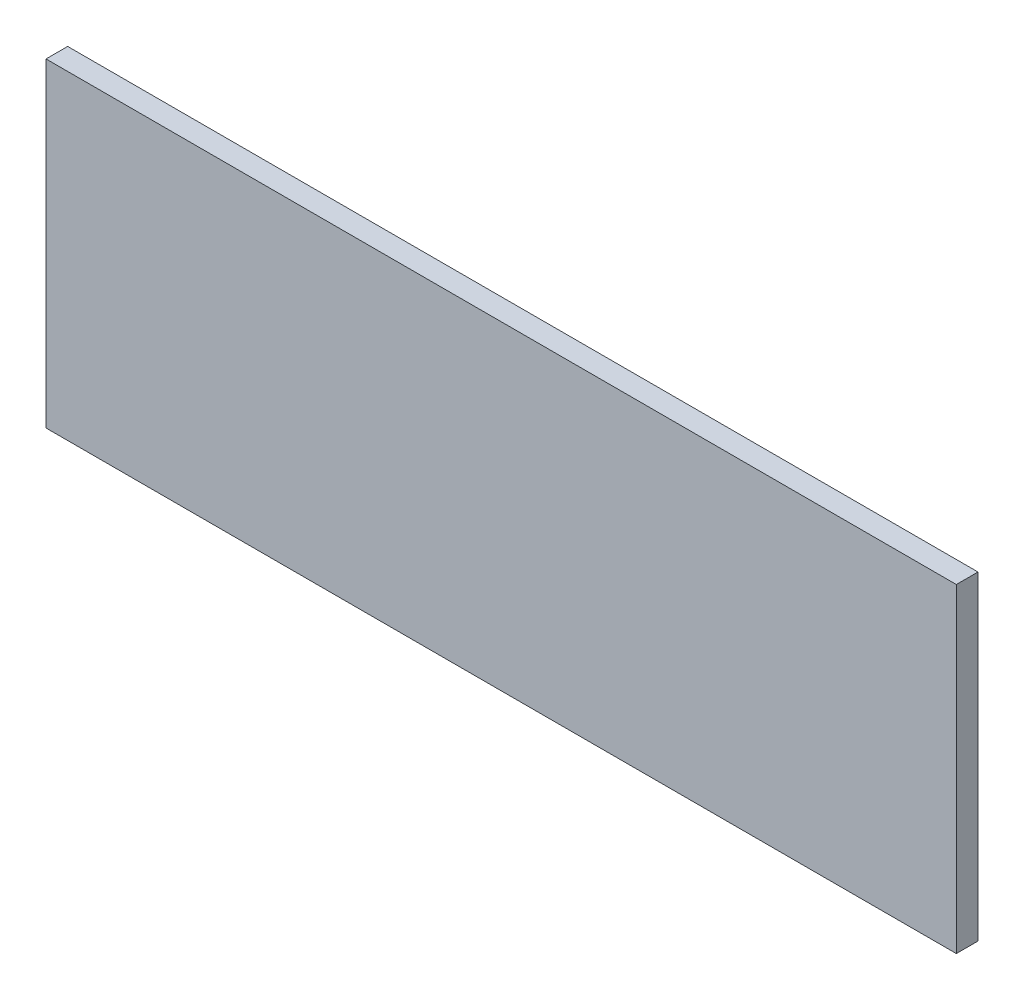
from build123d import *

# Parameters (mm, degrees)
SKETCH1_W           = 66.675
SKETCH1_H           = 23.41118
BOSS_EXTRUDE1_DEPTH = 1.5875


with BuildPart() as part:
    # Sketch1 → Boss-Extrude1 (new body)
    with BuildSketch(Plane.XY):
        with Locations((-8.637618068, 10.710124059)):
            Rectangle(SKETCH1_W, SKETCH1_H)
    extrude(amount=BOSS_EXTRUDE1_DEPTH)


solid = part.part
